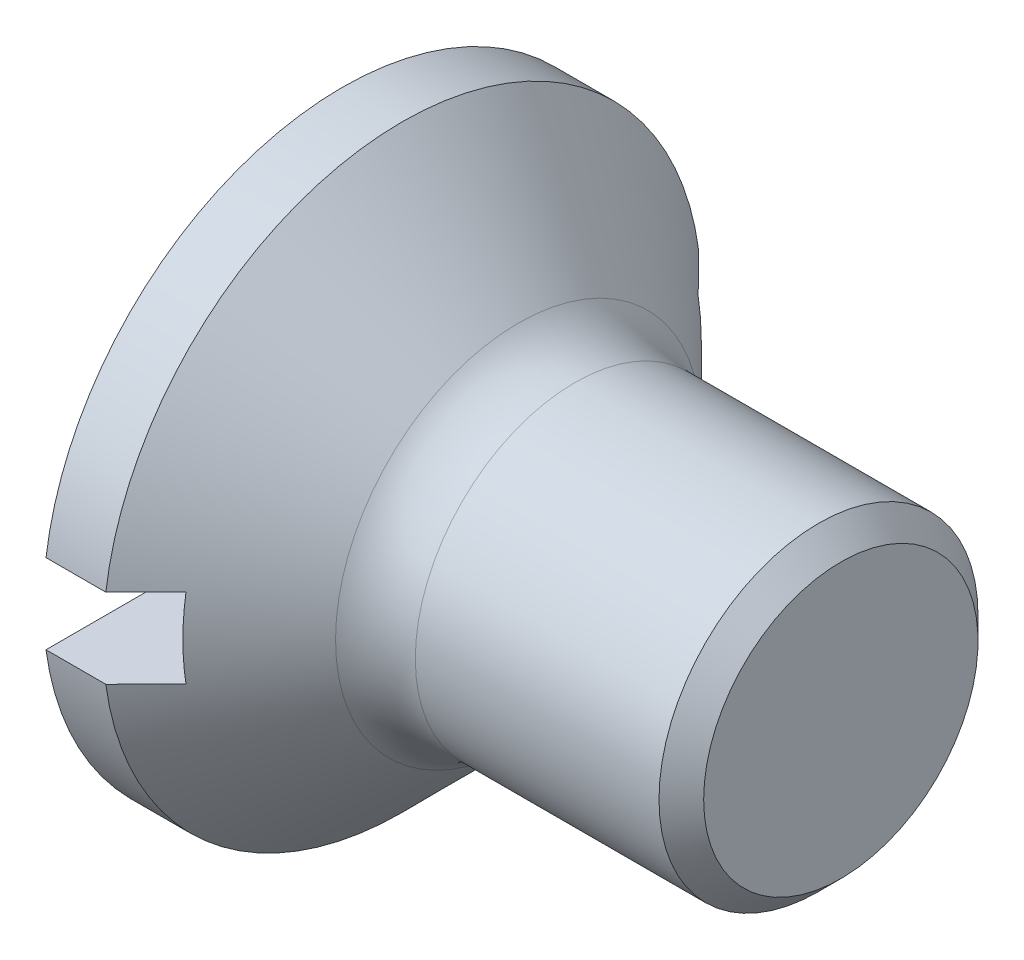
from build123d import *

# Parameters (mm, degrees)
ZAOBLIT1_R               = 0.4
ZKOSIT1_SIZE             = 0.112
SKICA2_W                 = 3
SKICA2_H                 = 0.4
ODEBRAT_VYSUNUT_M1_DEPTH = 0.5


with BuildPart() as part:
    # Skica1 → Otočit kolem osy1 (revolve)
    with BuildSketch(Plane.XY, mode=Mode.PRIVATE) as oto_it_kolem_osy1_sk:
        Polygon((0, 0), (0, 1.5), (0.3, 1.5), (1, 0.8), (2.5, 0.8), (2.5, 0), align=None)
    revolve(oto_it_kolem_osy1_sk.sketch.rotate(Axis((0, 0, 0), (-1, 0, 0)), 90), axis=Axis((0, 0, 0), (-1, 0, 0)))

    # Zaoblit1
    zaoblit1_edges = [part.edges().sort_by_distance(p)[0] for p in [
        (1, 0, 0.8),
    ]]
    fillet(zaoblit1_edges, radius=ZAOBLIT1_R)

    # Zkosit1
    zkosit1_edges = [part.edges().sort_by_distance(p)[0] for p in [
        (2.5, 0, 0.8),
    ]]
    chamfer(zkosit1_edges, length=ZKOSIT1_SIZE)

    # Skica2 → Odebrat vysunutím1 (cut)
    with BuildSketch(Plane.ZY):
        Rectangle(SKICA2_W, SKICA2_H)
    extrude(amount=-ODEBRAT_VYSUNUT_M1_DEPTH, mode=Mode.SUBTRACT)


solid = part.part
